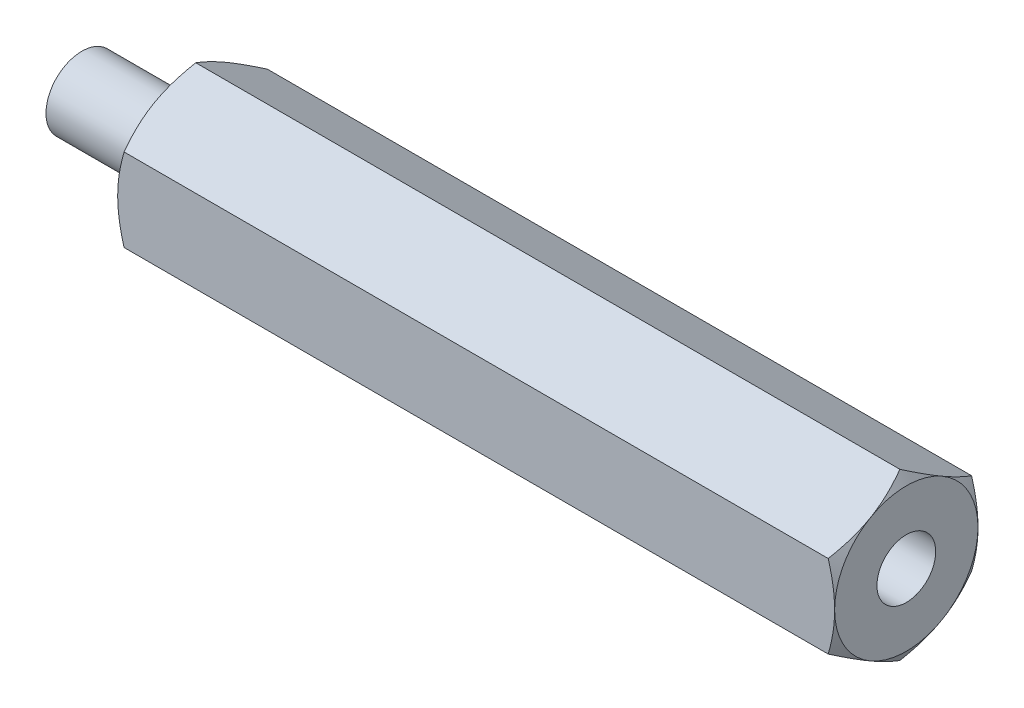
from build123d import *

# Parameters (mm, degrees)
BOSS_EXTRUDE1_DEPTH = 30
TAP1_D              = 2.459
TAP1_DEPTH          = 8.5
TAP1_TIP            = 0.738758131


with BuildPart() as part:
    # Sketch1 → Boss-Extrude1 (new body)
    with BuildSketch(Plane(origin=(0, 0, 0), x_dir=(0, 0, -1), z_dir=(1, 0, 0))):
        Polygon((3, 1.732050808), (0, 3.464101615), (-3, 1.732050808), (-3, -1.732050808), (0, -3.464101615), (3, -1.732050808), align=None)
    extrude(amount=BOSS_EXTRUDE1_DEPTH)

    # Sketch2 → Cut-Revolve1 (revolve, cut)
    with BuildSketch(Plane.XY):
        Polygon((0, 3.464101615), (0.267949192, 3.464101615), (0, 3), align=None)
        Polygon((29.732050808, 3.464101615), (30, 3), (30, 3.464101615), align=None)
    revolve(axis=Axis((-88.99, 0, 0), (1, 0, 0)), mode=Mode.SUBTRACT)

    # Tap1
    with Locations(Plane(origin=(30, -0.086368032, -2.129727113), x_dir=(0, 0, -1), z_dir=(1, 0, 0))):
        with Locations((-2.129727113, 0.086368032)):
            Hole(TAP1_D / 2, depth=TAP1_DEPTH)
            with Locations((0, 0, -(TAP1_DEPTH + TAP1_TIP / 2))):  # 118° drill point
                Cone(0, TAP1_D / 2, TAP1_TIP, mode=Mode.SUBTRACT)

    # Sketch5 → Revolve1 (revolve)
    with BuildSketch(Plane.XY):
        Polygon((0, 1.15), (-1, 1.15), (-1, 1.5), (-4.5, 1.5), (-4.5, 0), (0, 0), align=None)
    revolve(axis=Axis((-88.99, 0, 0), (1, 0, 0)))


solid = part.part
